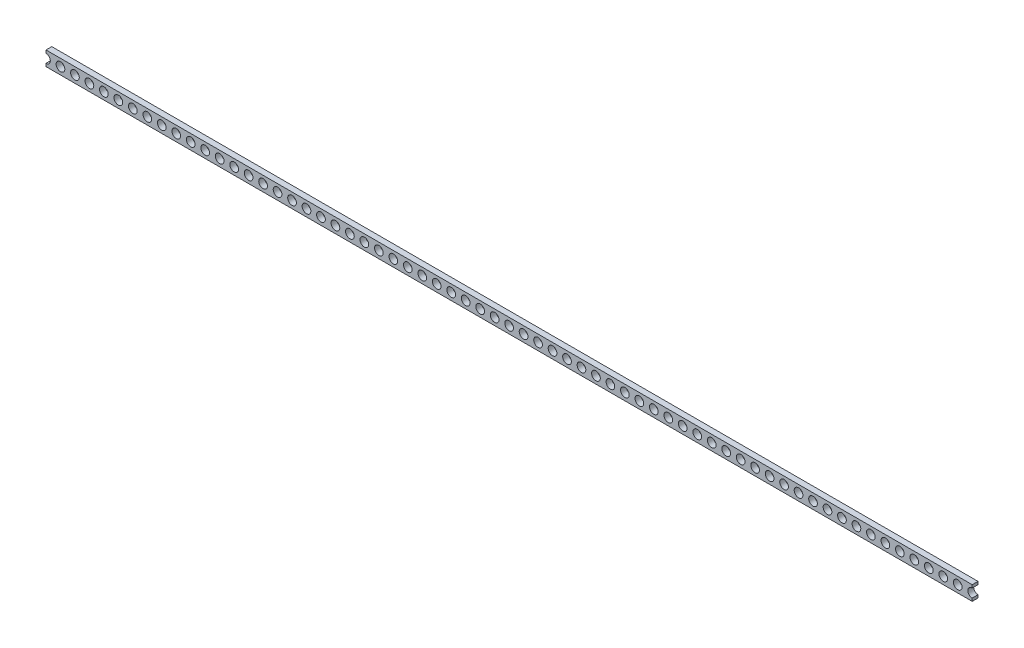
from build123d import *

# Parameters (mm, degrees)
SKETCH_1_W             = 320
SKETCH_1_H             = 5
EXTRUDE_1_DEPTH        = 2
SKETCH_2_R             = 1.5
CUT_EXTRUDE_1_DEPTH    = 321.045309292
PATTERN_LINEAR_1_COUNT = 35
PATTERN_LINEAR_1_PITCH = 5
PATTERN_LINEAR_2_COUNT = 35
PATTERN_LINEAR_2_PITCH = 5


with BuildPart() as part:
    # 草图1 → 凸台-拉伸1 (new body)
    with BuildSketch(Plane.XY):
        with Locations((160, -2.5)):
            Rectangle(SKETCH_1_W, SKETCH_1_H)
    extrude(amount=EXTRUDE_1_DEPTH)

    # 草图2 → 切除-拉伸1 (cut, through all)
    with BuildSketch(Plane.XY.offset(2)):
        with Locations((160, -2.5)):
            Circle(SKETCH_2_R)
    cut_extrude_1 = extrude(amount=-CUT_EXTRUDE_1_DEPTH, mode=Mode.SUBTRACT)

    # 阵列(线性)1: 切除-拉伸1 ×35
    with Locations(*[(i * PATTERN_LINEAR_1_PITCH, 0, 0) for i in range(1, PATTERN_LINEAR_1_COUNT)]):
        add(cut_extrude_1, mode=Mode.SUBTRACT)

    # 阵列(线性)2: 切除-拉伸1 ×35
    with Locations(*[(-i * PATTERN_LINEAR_2_PITCH, 0, 0) for i in range(1, PATTERN_LINEAR_2_COUNT)]):
        add(cut_extrude_1, mode=Mode.SUBTRACT)


solid = part.part
